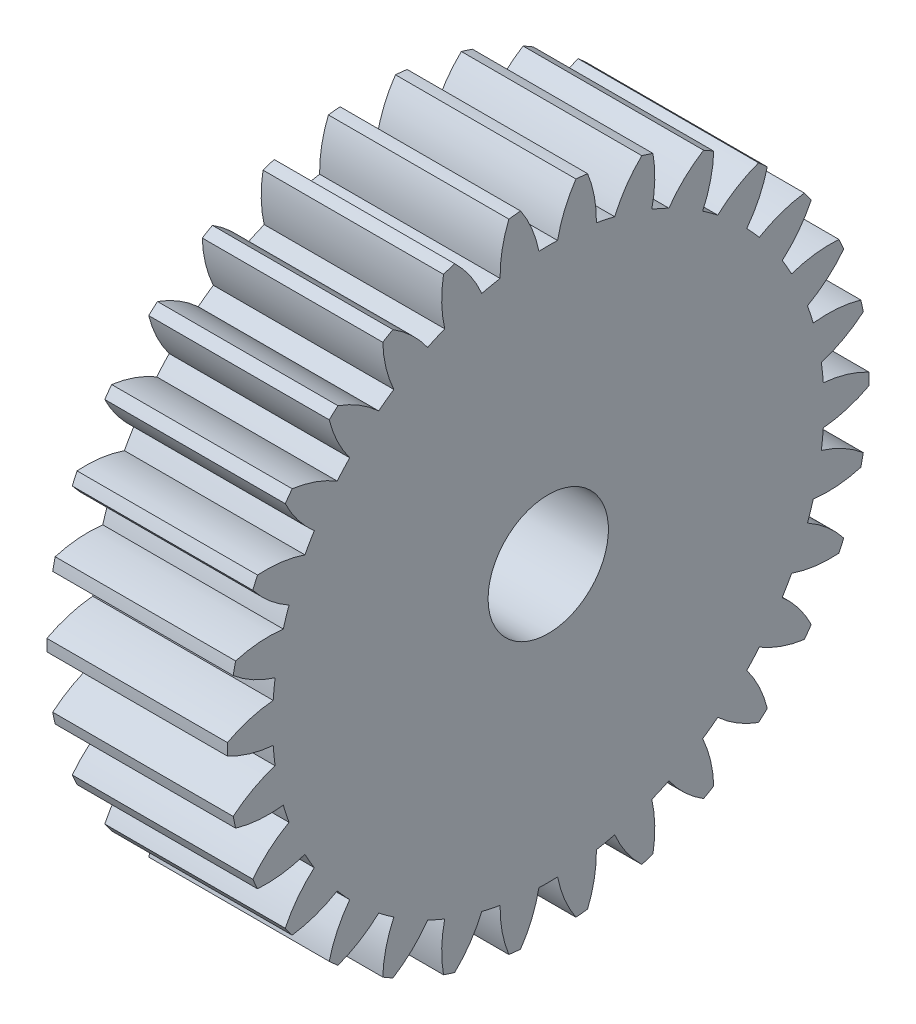
from build123d import *

# Parameters (mm, degrees)
BASPROSKE_W     = 9
BASPROSKE_H     = 16
TOOTHCUT_DEPTH  = 25.351591324
TEETHCUTS_COUNT = 30
TEETHCUTS_ANGLE = 348
BORSKE_R        = 3
BORE_DEPTH      = 50.0000508


with BuildPart() as part:
    # BasProSke → Base-Revolve (revolve)
    with BuildSketch(Plane(origin=(0, 0, 0), x_dir=(1, 0, 0), z_dir=(0, 1, 0)), mode=Mode.PRIVATE) as base_revolve_sk:
        with Locations((4.5, 8)):
            Rectangle(BASPROSKE_W, BASPROSKE_H)
    revolve(base_revolve_sk.sketch.rotate(Axis((-10, 0, 0), (1, 0, 0)), 180), axis=Axis((-10, 0, 0), (1, 0, 0)))

    # TooCutSke → ToothCut (cut, through all)
    with BuildSketch(Plane(origin=(0, 0, 0), x_dir=(0, 0, -1), z_dir=(1, 0, 0))):
        with BuildLine():
            ThreePointArc((0.466400716, 13.741086979), (0, 13.749), (-0.466400716, 13.741086979))
            ThreePointArc((-0.466400716, 13.741086979), (-0.819142092, 14.899954875), (-1.3974676, 15.964351834))
            ThreePointArc((-1.3974676, 15.964351834), (0, 16.0254), (1.3974676, 15.964351834))
            ThreePointArc((1.3974676, 15.964351834), (0.819142092, 14.899954875), (0.466400716, 13.741086979))
        make_face()
    toothcut = extrude(amount=TOOTHCUT_DEPTH, mode=Mode.SUBTRACT)

    # TeethCuts: ToothCut ×30 about axis
    teethcuts_axis = Axis((-10, 0, 0), (1, 0, 0))
    for i in range(1, TEETHCUTS_COUNT):
        add(toothcut.rotate(teethcuts_axis, i * TEETHCUTS_ANGLE / (TEETHCUTS_COUNT - 1)), mode=Mode.SUBTRACT)

    # BorSke → Bore (cut, symmetric)
    with BuildSketch(Plane(origin=(0, 0, 0), x_dir=(0, 0, -1), z_dir=(1, 0, 0))):
        with Locations(Location((0, 0, 0), (0, 0, 180))):
            Circle(BORSKE_R)
    extrude(amount=BORE_DEPTH, both=True, mode=Mode.SUBTRACT)


solid = part.part
